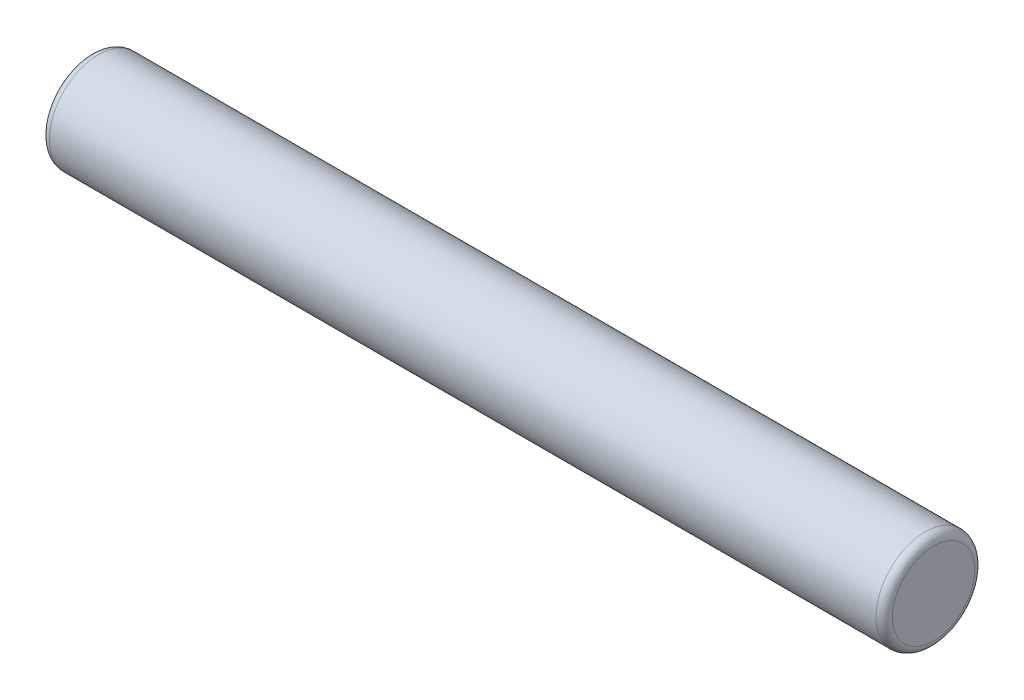
from build123d import *

# Parameters (mm, degrees)
SKETCH_1_R      = 1.5
EXTRUDE_1_DEPTH = 25.65
FILLET_1_R      = 0.25


with BuildPart() as part:
    # ｽｹｯﾁ1 → ﾎﾞｽ - 押し出し1 (new body)
    with BuildSketch(Plane(origin=(0, 0, 0), x_dir=(0, 0, -1), z_dir=(1, 0, 0))):
        Circle(SKETCH_1_R)
    extrude(amount=EXTRUDE_1_DEPTH)

    # ﾌｨﾚｯﾄ1
    fillet_1_edges = [part.edges().sort_by_distance(p)[0] for p in [
        (0, 0, 1.5),
        (25.65, 0, 1.5),
    ]]
    fillet(fillet_1_edges, radius=FILLET_1_R)


solid = part.part
